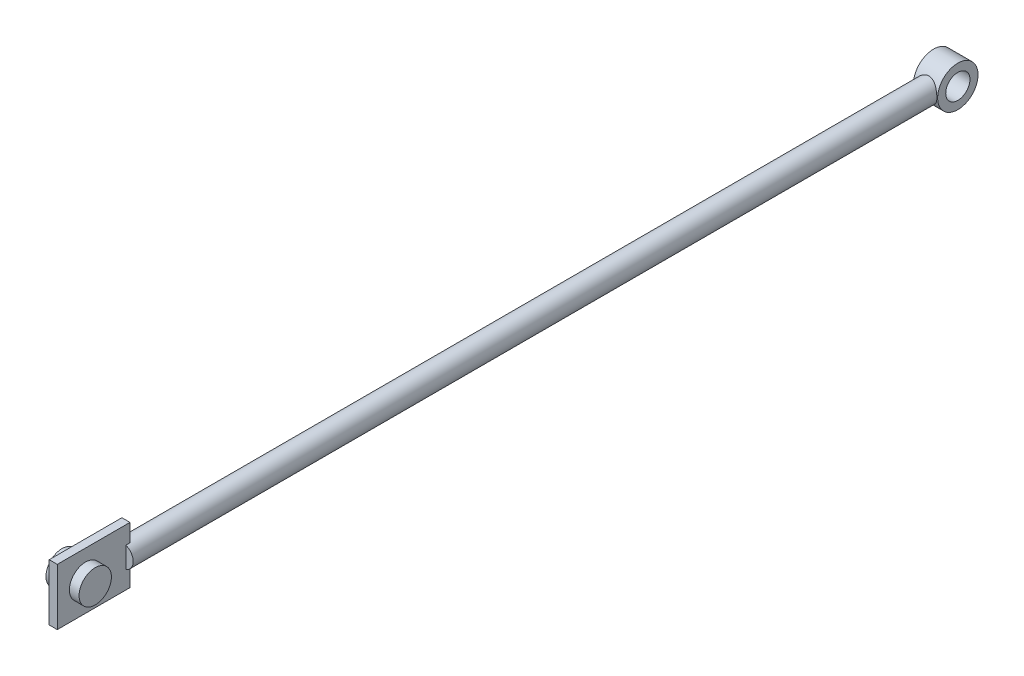
from build123d import *

# Parameters (mm, degrees)
SKETCH1_R                = 1.4
BOSS_EXTRUDE1_DEPTH      = 100
SKETCH2_W                = 3
SKETCH2_H                = 1
SKETCH3_W                = 1
SKETCH3_H                = 7
BOSS_EXTRUDE2_DEPTH      = 9
BOSS_EXTRUDE3_DEPTH      = 1.7
BOSS_EXTRUDE3_DEPTH_BACK = 2.4
SKETCH4_R                = 2


with BuildPart() as part:
    # Sketch1 → Boss-Extrude1 (new body)
    with BuildSketch(Plane.XY):
        Circle(SKETCH1_R)
    extrude(amount=BOSS_EXTRUDE1_DEPTH)

    # Sketch2 → Revolve1 (revolve)
    with BuildSketch(Plane(origin=(0, 0, 0), x_dir=(1, 0, 0), z_dir=(0, 1, 0))):
        Rectangle(SKETCH2_W, SKETCH2_H)
    revolve(axis=Axis((-2.442552493, 0, -2), (1, 0, 0)))

    # Sketch3 → Boss-Extrude2 (add)
    with BuildSketch(Plane.XY.offset(99.5)):
        Rectangle(SKETCH3_W, SKETCH3_H)
    extrude(amount=BOSS_EXTRUDE2_DEPTH)

    # Sketch4 → Boss-Extrude3 (add, two sides: drawn at the far end of the back side and taken through both)
    with BuildSketch(Plane(origin=(0, 0, 0), x_dir=(0, 0, -1), z_dir=(1, 0, 0)).offset(-BOSS_EXTRUDE3_DEPTH_BACK)):
        with Locations((-105, 0)):
            Circle(SKETCH4_R)
    extrude(amount=BOSS_EXTRUDE3_DEPTH + BOSS_EXTRUDE3_DEPTH_BACK)


solid = part.part
